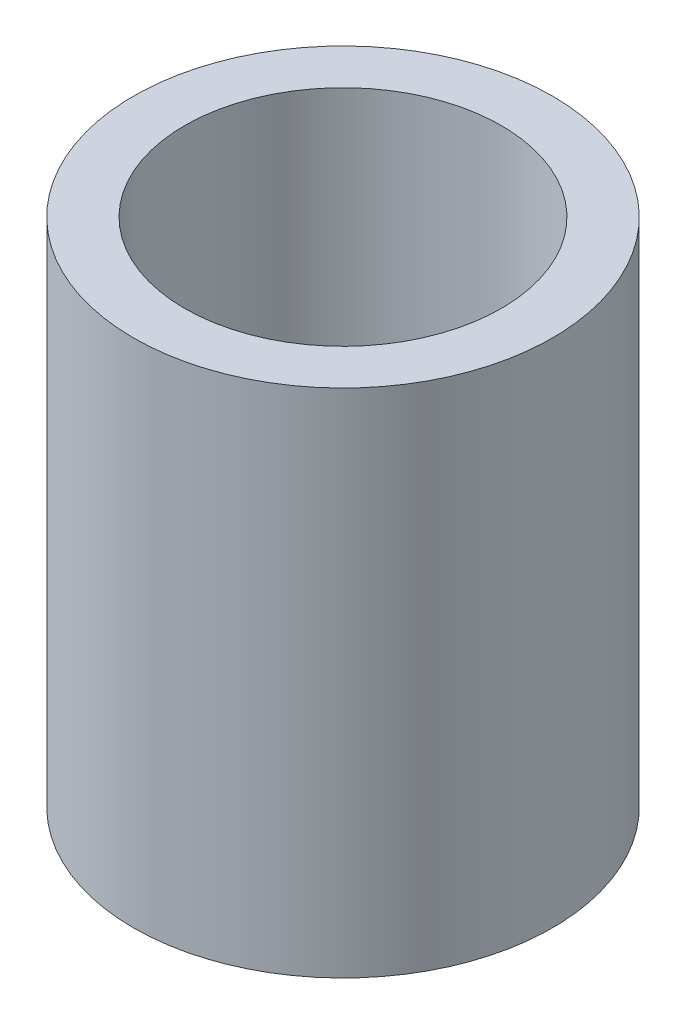
from build123d import *

# Parameters (mm, degrees)
SKETCH1_R           = 2.05
SKETCH1_R_2         = 1.55
BOSS_EXTRUDE1_DEPTH = 5


with BuildPart() as part:
    # Sketch1 → Boss-Extrude1 (new body)
    with BuildSketch(Plane(origin=(0, 0, 0), x_dir=(1, 0, 0), z_dir=(0, 1, 0))):
        with Locations(Location((0, 0, 0), (0, 0, 270))):
            Circle(SKETCH1_R)
        with Locations(Location((0, 0, 0), (0, 0, 270))):
            Circle(SKETCH1_R_2, mode=Mode.SUBTRACT)
    extrude(amount=BOSS_EXTRUDE1_DEPTH)


solid = part.part
